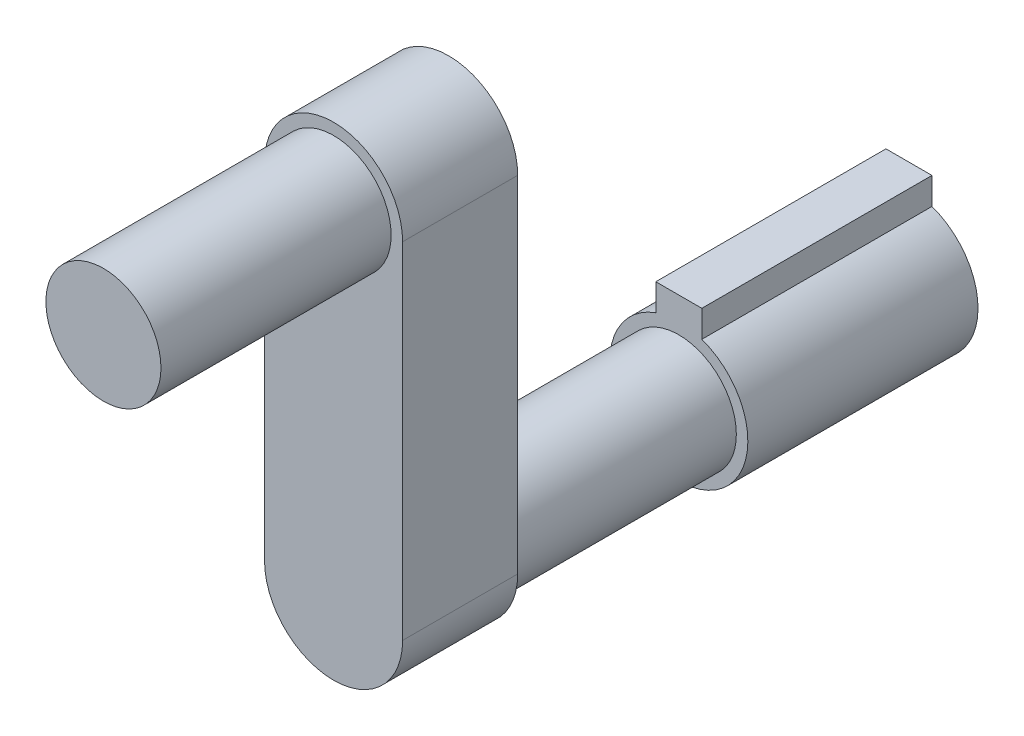
from build123d import *

# Parameters (mm, degrees)
SKETCH1_R           = 3
SKETCH1_W           = 2
SKETCH1_H           = 1.993597438
BOSS_EXTRUDE1_DEPTH = 10
SKETCH2_R           = 2.5
BOSS_EXTRUDE2_DEPTH = 10
BOSS_EXTRUDE3_DEPTH = 5
SKETCH4_R           = 2.5
BOSS_EXTRUDE4_DEPTH = 10
CUT_EXTRUDE1_DEPTH  = 2


with BuildPart() as part:
    # Sketch1 → Boss-Extrude1 (new body)
    with BuildSketch(Plane.XY):
        Circle(SKETCH1_R)
        with Locations((0, 3)):
            Rectangle(SKETCH1_W, SKETCH1_H)
    extrude(amount=BOSS_EXTRUDE1_DEPTH)

    # Sketch2 → Boss-Extrude2 (add)
    with BuildSketch(Plane.XY.offset(10)):
        Circle(SKETCH2_R)
    extrude(amount=BOSS_EXTRUDE2_DEPTH)

    # Sketch3 → Boss-Extrude3 (add)
    with BuildSketch(Plane.XY.offset(20)):
        with BuildLine():
            Line((-3, 0), (-3, 15))
            ThreePointArc((-3, 15), (0, 18), (3, 15))
            Line((3, 15), (3, 0))
            ThreePointArc((3, 0), (0, -3), (-3, 0))
        make_face()
    extrude(amount=BOSS_EXTRUDE3_DEPTH)

    # Sketch4 → Boss-Extrude4 (add)
    with BuildSketch(Plane.XY.offset(25)):
        with Locations((0, 15)):
            Circle(SKETCH4_R)
    extrude(amount=BOSS_EXTRUDE4_DEPTH)

    # Sketch5 → Cut-Extrude1 (cut)
    # profile 1 of 8: a face of its own
    with BuildSketch(Plane.ZY.offset(3)):
        Polygon((23.5, 13.967948718), (20, 13.070512821), (20, 13.266125801), (21.121794872, 13.553585737), (21.121794872, 14.427183494), (20, 14.714643429), (20, 14.91025641), (23.5, 14.012820513), align=None)
        Polygon((22.825520833, 13.990384615), (21.480769231, 14.335336538), (21.480769231, 13.645432692), align=None, mode=Mode.SUBTRACT)
    # profile 2 of 8: a face of its own
    with BuildSketch(Plane.ZY.offset(3)):
        with BuildLine():
            Line((23.5, 12.621794872), (23.5, 12.221454327))
            add(Edge.make_bspline(
                [(23.5, 12.221454327), (23.499948572, 12.193873317), (23.499850043, 12.14103227), (23.496829887, 12.065299003), (23.492819595, 11.996550011), (23.487166239, 11.934836389), (23.480740953, 11.880183731), (23.471213625, 11.832801839), (23.46158277, 11.79188376), (23.451886864, 11.767742603), (23.447415865, 11.756610577)],
                knots=[0, 0, 0, 0, 1.407566913, 2.696685497, 3.867828598, 4.921830392, 5.859837627, 6.673925321, 7.388517365, 8, 8, 8, 8], degree=3))
            add(Edge.make_bspline(
                [(23.447415865, 11.756610577), (23.440742683, 11.742401785), (23.427309393, 11.713799114), (23.40061655, 11.673724741), (23.370127993, 11.635008538), (23.333578412, 11.599209739), (23.293025391, 11.564675096), (23.24694992, 11.532611069), (23.196713988, 11.501525933), (23.121224336, 11.463838643), (23.016733365, 11.423225023), (22.877992506, 11.389292357), (22.724448317, 11.369175697), (22.617117752, 11.366683214), (22.561197917, 11.365384615)],
                knots=[0, 0, 0, 0, 0.553256377, 1.11371962, 1.694624179, 2.289471274, 2.915681027, 3.572429464, 4.268350826, 4.998658557, 6.547095669, 8.213347778, 10.027132616, 12, 12, 12, 12], degree=3))
            add(Edge.make_bspline(
                [(22.561197917, 11.365384615), (22.505040457, 11.366653019), (22.397468554, 11.369082697), (22.243792712, 11.389500794), (22.105167198, 11.4224302), (22.000701268, 11.46252034), (21.926479576, 11.501903223), (21.875700354, 11.532431814), (21.829889818, 11.566188171), (21.789171896, 11.602710912), (21.753006354, 11.641655154), (21.721235977, 11.683016894), (21.694502679, 11.727395269), (21.680077944, 11.758573392), (21.672876603, 11.774138622)],
                knots=[0, 0, 0, 0, 1.952825664, 3.74071718, 5.381229334, 6.899986293, 7.616370985, 8.302357478, 8.959256933, 9.592540697, 10.202323864, 10.80556878, 11.403697397, 12, 12, 12, 12], degree=3))
            add(Edge.make_bspline(
                [(21.672876603, 11.774138622), (21.668226346, 11.78692598), (21.65812948, 11.814690524), (21.646583821, 11.861177602), (21.636889356, 11.915285182), (21.629573612, 11.976893496), (21.623281999, 12.045862257), (21.618336994, 12.122301312), (21.615598245, 12.206476521), (21.615457864, 12.265155603), (21.615384615, 12.295773237)],
                knots=[0, 0, 0, 0, 0.619037079, 1.344083888, 2.176664384, 3.120122337, 4.167065244, 5.329031212, 6.606339038, 8, 8, 8, 8], degree=3))
            Line((21.615384615, 12.295773237), (21.615384615, 12.442307692))
            Line((21.615384615, 12.442307692), (20, 12.442307692))
            Line((20, 12.442307692), (20, 12.621794872))
            Line((20, 12.621794872), (23.5, 12.621794872))
        make_face()
        with BuildLine():
            Line((23.141025641, 12.442307692), (21.974358974, 12.442307692))
            Line((21.974358974, 12.442307692), (21.966646635, 12.08193109))
            add(Edge.make_bspline(
                [(21.966646635, 12.08193109), (21.967359882, 12.047765269), (21.968684053, 11.984335173), (21.980486749, 11.896366104), (21.999024216, 11.822445749), (22.027619308, 11.761358247), (22.067149294, 11.711971357), (22.114700665, 11.668520799), (22.172928457, 11.631765674), (22.239620796, 11.600444215), (22.313035684, 11.575575282), (22.391859477, 11.558415561), (22.474368458, 11.54656598), (22.531006416, 11.545442741), (22.559795673, 11.544871795)],
                knots=[0, 0, 0, 0, 1.329792904, 2.468809182, 3.448961848, 4.287442407, 5.072039685, 5.896626355, 6.785171559, 7.741805687, 8.760572816, 9.796030922, 10.879715384, 12, 12, 12, 12], degree=3))
            add(Edge.make_bspline(
                [(22.559795673, 11.544871795), (22.587884929, 11.545447785), (22.643360445, 11.546585349), (22.724451818, 11.558495045), (22.802370491, 11.575549106), (22.875241319, 11.600588848), (22.941179558, 11.631503631), (22.998337896, 11.667371524), (23.045219989, 11.707905073), (23.082787459, 11.755263451), (23.109987385, 11.813434052), (23.127801412, 11.884729229), (23.139894517, 11.970280353), (23.140629304, 12.032334067), (23.141025641, 12.065805288)],
                knots=[0, 0, 0, 0, 1.12019996, 2.212364431, 3.264487487, 4.299774154, 5.280209096, 6.165086333, 6.984581303, 7.742073155, 8.559708351, 9.525797634, 10.665437272, 12, 12, 12, 12], degree=3))
            Line((23.141025641, 12.065805288), (23.141025641, 12.442307692))
        make_face(mode=Mode.SUBTRACT)
    # profile 3 of 8: a face of its own
    with BuildSketch(Plane.ZY.offset(3)):
        with BuildLine():
            Line((20.675180288, 11.141025641), (20.852564103, 10.965745192))
            add(Edge.make_bspline(
                [(20.852564103, 10.965745192), (20.806768346, 10.949744611), (20.720259541, 10.919519296), (20.601283703, 10.867798877), (20.500574658, 10.814026459), (20.416955282, 10.759199354), (20.352394551, 10.700886474), (20.304628194, 10.641252453), (20.274867785, 10.577996502), (20.271073827, 10.534130211), (20.269230769, 10.512820513)],
                knots=[0, 0, 0, 0, 1.492748025, 2.819821212, 3.988082992, 5.003566528, 5.889522271, 6.653521704, 7.345897614, 8, 8, 8, 8], degree=3))
            add(Edge.make_bspline(
                [(20.269230769, 10.512820513), (20.270111185, 10.494706829), (20.27188161, 10.458282067), (20.288542594, 10.404973591), (20.313881925, 10.35310121), (20.349955227, 10.304450531), (20.394391746, 10.259470854), (20.446271202, 10.219579999), (20.505336751, 10.185747632), (20.570321687, 10.157903991), (20.640106799, 10.136880794), (20.712163446, 10.120294045), (20.786667151, 10.111298426), (20.836884225, 10.109756968), (20.862379808, 10.108974359)],
                knots=[0, 0, 0, 0, 0.821828617, 1.652613082, 2.517772712, 3.438355577, 4.392920542, 5.385775988, 6.404911499, 7.480990239, 8.593819133, 9.715597115, 10.840191616, 12, 12, 12, 12], degree=3))
            add(Edge.make_bspline(
                [(20.862379808, 10.108974359), (20.891402852, 10.11005785), (20.949740995, 10.112235735), (21.036598401, 10.125568379), (21.122569089, 10.148995054), (21.177851345, 10.171275695), (21.205929487, 10.182592147)],
                knots=[0, 0, 0, 0, 0.984692046, 1.979292873, 2.97367247, 4, 4, 4, 4], degree=3))
            add(Edge.make_bspline(
                [(21.205929487, 10.182592147), (21.2259099, 10.191707025), (21.267397259, 10.210633171), (21.329547689, 10.24473407), (21.394866872, 10.283548669), (21.463581418, 10.326621416), (21.53451747, 10.376304059), (21.60856967, 10.430841495), (21.685732977, 10.490432906), (21.737474218, 10.532567574), (21.764022436, 10.554186699)],
                knots=[0, 0, 0, 0, 0.783604451, 1.62707747, 2.528335987, 3.495652022, 4.520695746, 5.618471111, 6.778047299, 8, 8, 8, 8], degree=3))
            add(Edge.make_bspline(
                [(21.764022436, 10.554186699), (21.790327899, 10.575817605), (21.840937447, 10.61743369), (21.915220737, 10.6750916), (21.982925819, 10.727484922), (22.045807706, 10.772188301), (22.101954598, 10.811633595), (22.153108417, 10.844084503), (22.197860511, 10.871049082), (22.226899839, 10.885063516), (22.240084135, 10.891426282)],
                knots=[0, 0, 0, 0, 1.39810774, 2.689844348, 3.860446666, 4.91224624, 5.857076204, 6.676854451, 7.399271836, 8, 8, 8, 8], degree=3))
            add(Edge.make_bspline(
                [(22.240084135, 10.891426282), (22.281535116, 10.909330783), (22.364628719, 10.945222563), (22.49666208, 10.979697801), (22.633061017, 11.002816857), (22.725861195, 11.005200889), (22.772936699, 11.006410256)],
                knots=[0, 0, 0, 0, 0.985017337, 1.9745887, 2.97255308, 4, 4, 4, 4], degree=3))
            add(Edge.make_bspline(
                [(22.772936699, 11.006410256), (22.809895808, 11.005578534), (22.882606434, 11.003942265), (22.989037414, 10.991785873), (23.090720373, 10.972471363), (23.186185505, 10.944516167), (23.274692259, 10.909820473), (23.354140424, 10.868273136), (23.42312148, 10.819061497), (23.482085686, 10.765021127), (23.529393155, 10.705898409), (23.565034831, 10.643896093), (23.585277552, 10.577847578), (23.588258236, 10.533043967), (23.58974359, 10.510717147)],
                knots=[0, 0, 0, 0, 1.267016723, 2.492635209, 3.668164557, 4.811825255, 5.898095375, 6.923330359, 7.877218101, 8.795783379, 9.656795591, 10.463916073, 11.234528935, 12, 12, 12, 12], degree=3))
            add(Edge.make_bspline(
                [(23.58974359, 10.510717147), (23.5882948, 10.486913885), (23.5853668, 10.438807577), (23.559692893, 10.368495535), (23.518544339, 10.301364186), (23.472815592, 10.247909946), (23.426756089, 10.207015443), (23.385343905, 10.174522649), (23.336613034, 10.142713646), (23.28174963, 10.109571422), (23.22022471, 10.076119089), (23.151806874, 10.042487042), (23.076931172, 10.008255385), (23.024459527, 9.985921119), (22.997295673, 9.974358974)],
                knots=[0, 0, 0, 0, 1.010981439, 2.043189844, 3.145628199, 4.352312797, 5.021689429, 5.766145213, 6.591348155, 7.497533611, 8.495006426, 9.571955896, 10.743034757, 12, 12, 12, 12], degree=3))
            Line((22.997295673, 9.974358974), (22.782051282, 10.142628205))
            add(Edge.make_bspline(
                [(22.782051282, 10.142628205), (22.804091142, 10.152288961), (22.846333135, 10.170804942), (22.905921581, 10.199874505), (22.959817354, 10.22695967), (23.00791356, 10.252878859), (23.049844193, 10.278188247), (23.086624211, 10.301856812), (23.117421928, 10.32470919), (23.149748667, 10.353331722), (23.1821268, 10.3891426), (23.210074363, 10.435250101), (23.22739846, 10.48358194), (23.229647669, 10.516659167), (23.230769231, 10.533153045)],
                knots=[0, 0, 0, 0, 1.380595433, 2.64607415, 3.803495892, 4.841587401, 5.779871171, 6.612990388, 7.350514443, 7.977472631, 9.088846696, 10.105320781, 11.055222839, 12, 12, 12, 12], degree=3))
            add(Edge.make_bspline(
                [(23.230769231, 10.533153045), (23.229466025, 10.553993228), (23.226879653, 10.595353163), (23.200229207, 10.653197448), (23.158609652, 10.704394743), (23.102186882, 10.747542162), (23.034979737, 10.782907324), (22.959113836, 10.808922792), (22.875702371, 10.824492041), (22.817643664, 10.826095169), (22.787660256, 10.826923077)],
                knots=[0, 0, 0, 0, 0.845592901, 1.678184239, 2.546323166, 3.517236357, 4.553727469, 5.633226106, 6.777720882, 8, 8, 8, 8], degree=3))
            add(Edge.make_bspline(
                [(22.787660256, 10.826923077), (22.750387151, 10.825699916), (22.67608552, 10.823261621), (22.584324909, 10.803490171), (22.51133772, 10.78025331), (22.454315857, 10.756931592), (22.395131376, 10.727210632), (22.355856614, 10.703785746), (22.335436699, 10.691606571)],
                knots=[0, 0, 0, 0, 1.400397992, 2.791606777, 3.511596025, 4.280421619, 5.105948858, 6, 6, 6, 6], degree=3))
            add(Edge.make_bspline(
                [(22.335436699, 10.691606571), (22.328629806, 10.686973989), (22.312702373, 10.676134223), (22.286164667, 10.656336006), (22.252886535, 10.630677518), (22.212360804, 10.599538138), (22.165695624, 10.561515935), (22.112075938, 10.517936402), (22.052024155, 10.468091917), (22.009431655, 10.433106109), (21.986979167, 10.414663462)],
                knots=[0, 0, 0, 0, 0.443798571, 1.038443339, 1.784280503, 2.709093875, 3.79317689, 5.028804332, 6.433744489, 8, 8, 8, 8], degree=3))
            add(Edge.make_bspline(
                [(21.986979167, 10.414663462), (21.959251456, 10.392356384), (21.905154971, 10.348835499), (21.824600774, 10.286903757), (21.746077579, 10.230701988), (21.669738407, 10.180349272), (21.596044549, 10.135071167), (21.524277277, 10.095877848), (21.455043102, 10.061186217), (21.366086296, 10.023327118), (21.255969344, 9.986123263), (21.123483627, 9.953647502), (20.990633516, 9.933002658), (20.901715055, 9.930655202), (20.857471955, 9.929487179)],
                knots=[0, 0, 0, 0, 1.019693231, 1.989411284, 2.911117387, 3.785919386, 4.609387671, 5.388618189, 6.128346314, 6.827399301, 8.157317944, 9.453423902, 10.732901827, 12, 12, 12, 12], degree=3))
            add(Edge.make_bspline(
                [(20.857471955, 9.929487179), (20.82614066, 9.930076639), (20.764318294, 9.931239751), (20.673197126, 9.938920996), (20.585102646, 9.952174904), (20.500180282, 9.971337739), (20.418022269, 9.994871377), (20.339209417, 10.024338207), (20.264043042, 10.05983885), (20.192374853, 10.09894006), (20.127091719, 10.14281746), (20.069191326, 10.188826711), (20.020296616, 10.237350223), (19.980305384, 10.288382091), (19.949237443, 10.341999239), (19.926423444, 10.397799424), (19.91242622, 10.456276988), (19.910985421, 10.49615087), (19.91025641, 10.516326122)],
                knots=[0, 0, 0, 0, 1.230704376, 2.428404448, 3.58911904, 4.727250619, 5.845775478, 6.943883352, 8.028127475, 9.108829135, 10.147661164, 11.113991069, 12.009808747, 12.847178372, 13.653371422, 14.435851608, 15.208577505, 16, 16, 16, 16], degree=3))
            add(Edge.make_bspline(
                [(19.91025641, 10.516326122), (19.910770129, 10.531796761), (19.911797391, 10.56273273), (19.920945594, 10.608459304), (19.933540426, 10.653600292), (19.954152118, 10.696602395), (19.978653207, 10.73905966), (20.008952633, 10.78043382), (20.044954232, 10.820504418), (20.08685797, 10.859266992), (20.134941163, 10.897518539), (20.190516104, 10.934379106), (20.253425045, 10.970779136), (20.323000756, 11.007405545), (20.400992001, 11.04130673), (20.485526413, 11.075687299), (20.577635891, 11.109454449), (20.641919898, 11.130260593), (20.675180288, 11.141025641)],
                knots=[0, 0, 0, 0, 0.703637613, 1.407033772, 2.117478485, 2.831738548, 3.570931179, 4.347844512, 5.161774225, 6.020127363, 6.944175601, 7.956531597, 9.053447769, 10.252889659, 11.534358192, 12.923572509, 14.408263844, 16, 16, 16, 16], degree=3))
        make_face()
    # profile 4 of 8: a face of its own
    with BuildSketch(Plane.ZY.offset(3)):
        with BuildLine():
            Line((22.857772436, 7.596153846), (22.647435897, 7.758814103))
            add(Edge.make_bspline(
                [(22.647435897, 7.758814103), (22.692776531, 7.781562664), (22.780085367, 7.82536775), (22.898713127, 7.902425364), (22.999368999, 7.987162247), (23.082960794, 8.077847119), (23.149419037, 8.174293004), (23.196147677, 8.276800328), (23.225803666, 8.383960886), (23.229109375, 8.457410489), (23.230769231, 8.494290865)],
                knots=[0, 0, 0, 0, 1.225477736, 2.359804546, 3.409995788, 4.397567392, 5.332917671, 6.22771367, 7.110102915, 8, 8, 8, 8], degree=3))
            add(Edge.make_bspline(
                [(23.230769231, 8.494290865), (23.230371308, 8.514671172), (23.229579787, 8.555210255), (23.218824088, 8.615217769), (23.203770677, 8.67429278), (23.181842411, 8.732121428), (23.15323281, 8.788310229), (23.11986102, 8.844258716), (23.078457637, 8.897894324), (23.032595156, 8.951295719), (22.980659196, 9.002000981), (22.924710389, 9.050571148), (22.863992152, 9.095408038), (22.799387496, 9.137568468), (22.730486537, 9.176745082), (22.657466242, 9.213570951), (22.579630116, 9.245967297), (22.469986252, 9.28682551), (22.324700804, 9.328957718), (22.141294595, 9.365200338), (21.947329078, 9.387428306), (21.814563757, 9.389806388), (21.746494391, 9.391025641)],
                knots=[0, 0, 0, 0, 0.641072609, 1.27517683, 1.914344945, 2.55962964, 3.218006293, 3.89843944, 4.608029295, 5.348959021, 6.11410062, 6.891744901, 7.680836169, 8.489326988, 9.320160762, 10.176050412, 11.063333565, 11.97397225, 13.860712496, 15.819659649, 17.856721063, 20, 20, 20, 20], degree=3))
            add(Edge.make_bspline(
                [(21.746494391, 9.391025641), (21.69482339, 9.390186649), (21.593677813, 9.388544327), (21.44520389, 9.376599632), (21.30357498, 9.356283793), (21.168095448, 9.328392679), (21.039268968, 9.291954872), (20.916528732, 9.247862874), (20.800788839, 9.195174454), (20.692524641, 9.135413917), (20.594193036, 9.06929511), (20.507237078, 8.998929269), (20.434271735, 8.923125189), (20.373905308, 8.843654699), (20.326671882, 8.759282045), (20.294089239, 8.670225713), (20.272317585, 8.577365052), (20.270267571, 8.513812566), (20.269230769, 8.481670673)],
                knots=[0, 0, 0, 0, 1.296265952, 2.537430365, 3.733959494, 4.883883303, 6.00498481, 7.090011517, 8.152708702, 9.192034827, 10.188898666, 11.122065806, 11.992878817, 12.821949746, 13.619810597, 14.408309511, 15.19499696, 16, 16, 16, 16], degree=3))
            add(Edge.make_bspline(
                [(20.269230769, 8.481670673), (20.270922193, 8.446192082), (20.274278583, 8.375789876), (20.303374225, 8.272835141), (20.349321451, 8.174434002), (20.414409923, 8.080964022), (20.498095468, 7.992945323), (20.598979308, 7.90875097), (20.718417494, 7.829322479), (20.806528823, 7.78301056), (20.852564103, 7.758814103)],
                knots=[0, 0, 0, 0, 0.867201894, 1.720838504, 2.598846134, 3.516224563, 4.495888817, 5.564045298, 6.727293588, 8, 8, 8, 8], degree=3))
            Line((20.852564103, 7.758814103), (20.644330929, 7.596153846))
            add(Edge.make_bspline(
                [(20.644330929, 7.596153846), (20.615918925, 7.608725144), (20.559877676, 7.633521397), (20.479693328, 7.67486851), (20.404115156, 7.718279745), (20.334032458, 7.764938338), (20.268062191, 7.812810104), (20.20760461, 7.863630609), (20.151801283, 7.916256218), (20.101395944, 7.971551828), (20.056465211, 8.028870121), (20.017545657, 8.088224701), (19.984654117, 8.149287817), (19.95702617, 8.211742628), (19.93583031, 8.275843217), (19.921275326, 8.341635313), (19.911655632, 8.408936304), (19.910724736, 8.454527436), (19.91025641, 8.477463942)],
                knots=[0, 0, 0, 0, 1.224426466, 2.415119558, 3.554345693, 4.6581201, 5.73232009, 6.765566526, 7.769062807, 8.753735059, 9.711981524, 10.636925446, 11.547863011, 12.443012552, 13.325703329, 14.204008697, 15.096452203, 16, 16, 16, 16], degree=3))
            add(Edge.make_bspline(
                [(19.91025641, 8.477463942), (19.910525197, 8.499226939), (19.911058767, 8.542428775), (19.919442294, 8.606097868), (19.931024725, 8.66831055), (19.948125333, 8.728431503), (19.968943222, 8.787340414), (19.995900834, 8.843785966), (20.026830857, 8.898993571), (20.062866875, 8.952308189), (20.103177255, 9.004275168), (20.149652822, 9.053466579), (20.199735236, 9.10169909), (20.25465476, 9.14822303), (20.31464515, 9.192302272), (20.379055506, 9.235170321), (20.448740687, 9.275833629), (20.49744806, 9.30102856), (20.522335737, 9.313902244)],
                knots=[0, 0, 0, 0, 0.951483691, 1.888795086, 2.805292916, 3.718304322, 4.620775644, 5.535674798, 6.451430733, 7.387346612, 8.348778872, 9.325586392, 10.345339298, 11.390162498, 12.472057736, 13.600827389, 14.77411096, 16, 16, 16, 16], degree=3))
            add(Edge.make_bspline(
                [(20.522335737, 9.313902244), (20.566213736, 9.334686156), (20.654955946, 9.376721125), (20.795072835, 9.427751962), (20.941312353, 9.472197856), (21.094191709, 9.508558984), (21.253859985, 9.536643143), (21.420099274, 9.555795015), (21.592997845, 9.568080087), (21.710482113, 9.569691774), (21.770332532, 9.570512821)],
                knots=[0, 0, 0, 0, 0.906154086, 1.832675129, 2.781094794, 3.759121532, 4.764995586, 5.806439983, 6.882527099, 8, 8, 8, 8], degree=3))
            add(Edge.make_bspline(
                [(21.770332532, 9.570512821), (21.833233372, 9.569633734), (21.95664193, 9.567909007), (22.137760907, 9.552502), (22.31145268, 9.529515309), (22.477098713, 9.494650238), (22.63574796, 9.451649368), (22.786277141, 9.397497545), (22.929594662, 9.334258212), (23.063606808, 9.261942745), (23.186641678, 9.183357473), (23.29374504, 9.097691409), (23.384605272, 9.007241351), (23.460193508, 8.912367199), (23.518222624, 8.811356718), (23.559463276, 8.705261651), (23.584847836, 8.594341217), (23.588103016, 8.518494388), (23.58974359, 8.480268429)],
                knots=[0, 0, 0, 0, 1.293843798, 2.538462092, 3.737286409, 4.896222341, 6.018388779, 7.116449574, 8.184140796, 9.238277773, 10.246533469, 11.183676305, 12.054053577, 12.879343071, 13.671938145, 14.440724158, 15.214142311, 16, 16, 16, 16], degree=3))
            add(Edge.make_bspline(
                [(23.58974359, 8.480268429), (23.589265029, 8.456868419), (23.588318489, 8.41058576), (23.578943888, 8.342242038), (23.563308865, 8.275928149), (23.542122794, 8.211235209), (23.515624497, 8.147542318), (23.481651363, 8.086152975), (23.442301391, 8.026352748), (23.397244053, 7.968702205), (23.346545213, 7.913485507), (23.291298803, 7.860021701), (23.230587774, 7.809858034), (23.166070978, 7.760860797), (23.095876913, 7.715831225), (23.021227962, 7.672568151), (22.94130863, 7.632990509), (22.885912543, 7.60856269), (22.857772436, 7.596153846)],
                knots=[0, 0, 0, 0, 0.92065626, 1.820957336, 2.709050054, 3.59923666, 4.49793837, 5.420064155, 6.356442129, 7.313336463, 8.296619297, 9.305055395, 10.336843872, 11.394752583, 12.491929066, 13.616981075, 14.789473945, 16, 16, 16, 16], degree=3))
        make_face()
    # profile 5 of 8: a face of its own
    with BuildSketch(Plane.ZY.offset(3)):
        with BuildLine():
            Line((23.5, 6.33974359), (23.5, 5.939403045))
            add(Edge.make_bspline(
                [(23.5, 5.939403045), (23.499948572, 5.911822035), (23.499850043, 5.858980988), (23.496829887, 5.783247721), (23.492819595, 5.714498729), (23.487166239, 5.652785107), (23.480740953, 5.598132449), (23.471213625, 5.550750557), (23.46158277, 5.509832478), (23.451886864, 5.485691321), (23.447415865, 5.474559295)],
                knots=[0, 0, 0, 0, 1.407566913, 2.696685497, 3.867828598, 4.921830392, 5.859837627, 6.673925321, 7.388517365, 8, 8, 8, 8], degree=3))
            add(Edge.make_bspline(
                [(23.447415865, 5.474559295), (23.440742683, 5.460350503), (23.427309393, 5.431747832), (23.40061655, 5.391673459), (23.370127993, 5.352957256), (23.333578412, 5.317158457), (23.293025391, 5.282623814), (23.24694992, 5.250559787), (23.196713988, 5.219474651), (23.121224336, 5.181787361), (23.016733365, 5.141173741), (22.877992506, 5.107241075), (22.724448317, 5.087124415), (22.617117752, 5.084631932), (22.561197917, 5.083333333)],
                knots=[0, 0, 0, 0, 0.553256377, 1.11371962, 1.694624179, 2.289471274, 2.915681027, 3.572429464, 4.268350826, 4.998658557, 6.547095669, 8.213347778, 10.027132616, 12, 12, 12, 12], degree=3))
            add(Edge.make_bspline(
                [(22.561197917, 5.083333333), (22.505040457, 5.084601737), (22.397468554, 5.087031415), (22.243792712, 5.107449512), (22.105167198, 5.140378918), (22.000701268, 5.180469058), (21.926479576, 5.219851941), (21.875700354, 5.250380532), (21.829889818, 5.284136889), (21.789171896, 5.32065963), (21.753006354, 5.359603872), (21.721235977, 5.400965612), (21.694502679, 5.445343987), (21.680077944, 5.47652211), (21.672876603, 5.49208734)],
                knots=[0, 0, 0, 0, 1.952825664, 3.74071718, 5.381229334, 6.899986293, 7.616370985, 8.302357478, 8.959256933, 9.592540697, 10.202323864, 10.80556878, 11.403697397, 12, 12, 12, 12], degree=3))
            add(Edge.make_bspline(
                [(21.672876603, 5.49208734), (21.668226346, 5.504874698), (21.65812948, 5.532639242), (21.646583821, 5.57912632), (21.636889356, 5.6332339), (21.629573612, 5.694842214), (21.623281999, 5.763810975), (21.618336994, 5.84025003), (21.615598245, 5.924425239), (21.615457864, 5.983104321), (21.615384615, 6.013721955)],
                knots=[0, 0, 0, 0, 0.619037079, 1.344083888, 2.176664384, 3.120122337, 4.167065244, 5.329031212, 6.606339038, 8, 8, 8, 8], degree=3))
            Line((21.615384615, 6.013721955), (21.615384615, 6.16025641))
            Line((21.615384615, 6.16025641), (20, 6.16025641))
            Line((20, 6.16025641), (20, 6.33974359))
            Line((20, 6.33974359), (23.5, 6.33974359))
        make_face()
        with BuildLine():
            Line((23.141025641, 6.16025641), (21.974358974, 6.16025641))
            Line((21.974358974, 6.16025641), (21.966646635, 5.799879808))
            add(Edge.make_bspline(
                [(21.966646635, 5.799879808), (21.967359882, 5.765713987), (21.968684053, 5.702283891), (21.980486749, 5.614314822), (21.999024216, 5.540394467), (22.027619308, 5.479306965), (22.067149294, 5.429920075), (22.114700665, 5.386469517), (22.172928457, 5.349714392), (22.239620796, 5.318392933), (22.313035684, 5.293524), (22.391859477, 5.276364279), (22.474368458, 5.264514698), (22.531006416, 5.263391459), (22.559795673, 5.262820513)],
                knots=[0, 0, 0, 0, 1.329792904, 2.468809182, 3.448961848, 4.287442407, 5.072039685, 5.896626355, 6.785171559, 7.741805687, 8.760572816, 9.796030922, 10.879715384, 12, 12, 12, 12], degree=3))
            add(Edge.make_bspline(
                [(22.559795673, 5.262820513), (22.587884929, 5.263396503), (22.643360445, 5.264534067), (22.724451818, 5.276443763), (22.802370491, 5.293497824), (22.875241319, 5.318537566), (22.941179558, 5.349452349), (22.998337896, 5.385320242), (23.045219989, 5.425853791), (23.082787459, 5.473212169), (23.109987385, 5.53138277), (23.127801412, 5.602677947), (23.139894517, 5.688229071), (23.140629304, 5.750282785), (23.141025641, 5.783754006)],
                knots=[0, 0, 0, 0, 1.12019996, 2.212364431, 3.264487487, 4.299774154, 5.280209096, 6.165086333, 6.984581303, 7.742073155, 8.559708351, 9.525797634, 10.665437272, 12, 12, 12, 12], degree=3))
            Line((23.141025641, 5.783754006), (23.141025641, 6.16025641))
        make_face(mode=Mode.SUBTRACT)
    # profile 6 of 8: a face of its own
    with BuildSketch(Plane.ZY.offset(3)):
        Polygon((23.5, 3.871794872), (20, 2.974358974), (20, 3.169971955), (21.121794872, 3.457431891), (21.121794872, 4.331029647), (20, 4.618489583), (20, 4.814102564), (23.5, 3.916666667), align=None)
        Polygon((22.825520833, 3.894230769), (21.480769231, 4.239182692), (21.480769231, 3.549278846), align=None, mode=Mode.SUBTRACT)
    # profile 7 of 8: a face of its own
    with BuildSketch(Plane.ZY.offset(3)):
        with BuildLine():
            Line((20.675180288, 2.75), (20.852564103, 2.574719551))
            add(Edge.make_bspline(
                [(20.852564103, 2.574719551), (20.806768346, 2.55871897), (20.720259541, 2.528493655), (20.601283703, 2.476773236), (20.500574658, 2.423000818), (20.416955282, 2.368173713), (20.352394551, 2.309860833), (20.304628194, 2.250226812), (20.274867785, 2.186970861), (20.271073827, 2.14310457), (20.269230769, 2.121794872)],
                knots=[0, 0, 0, 0, 1.492748025, 2.819821212, 3.988082992, 5.003566528, 5.889522271, 6.653521704, 7.345897614, 8, 8, 8, 8], degree=3))
            add(Edge.make_bspline(
                [(20.269230769, 2.121794872), (20.270111185, 2.103681188), (20.27188161, 2.067256426), (20.288542594, 2.01394795), (20.313881925, 1.962075569), (20.349955227, 1.91342489), (20.394391746, 1.868445213), (20.446271202, 1.828554358), (20.505336751, 1.794721991), (20.570321687, 1.76687835), (20.640106799, 1.745855153), (20.712163446, 1.729268404), (20.786667151, 1.720272785), (20.836884225, 1.718731327), (20.862379808, 1.717948718)],
                knots=[0, 0, 0, 0, 0.821828617, 1.652613082, 2.517772712, 3.438355577, 4.392920542, 5.385775988, 6.404911499, 7.480990239, 8.593819133, 9.715597115, 10.840191616, 12, 12, 12, 12], degree=3))
            add(Edge.make_bspline(
                [(20.862379808, 1.717948718), (20.891402852, 1.719032209), (20.949740995, 1.721210094), (21.036598401, 1.734542738), (21.122569089, 1.757969413), (21.177851345, 1.780250054), (21.205929487, 1.791566506)],
                knots=[0, 0, 0, 0, 0.984692046, 1.979292873, 2.97367247, 4, 4, 4, 4], degree=3))
            add(Edge.make_bspline(
                [(21.205929487, 1.791566506), (21.2259099, 1.800681384), (21.267397259, 1.81960753), (21.329547689, 1.853708429), (21.394866872, 1.892523028), (21.463581418, 1.935595775), (21.53451747, 1.985278418), (21.60856967, 2.039815854), (21.685732977, 2.099407265), (21.737474218, 2.141541933), (21.764022436, 2.163161058)],
                knots=[0, 0, 0, 0, 0.783604451, 1.62707747, 2.528335987, 3.495652022, 4.520695746, 5.618471111, 6.778047299, 8, 8, 8, 8], degree=3))
            add(Edge.make_bspline(
                [(21.764022436, 2.163161058), (21.790327899, 2.184791964), (21.840937447, 2.226408049), (21.915220737, 2.284065959), (21.982925819, 2.336459281), (22.045807706, 2.38116266), (22.101954598, 2.420607954), (22.153108417, 2.453058862), (22.197860511, 2.480023441), (22.226899839, 2.494037875), (22.240084135, 2.500400641)],
                knots=[0, 0, 0, 0, 1.39810774, 2.689844348, 3.860446666, 4.91224624, 5.857076204, 6.676854451, 7.399271836, 8, 8, 8, 8], degree=3))
            add(Edge.make_bspline(
                [(22.240084135, 2.500400641), (22.281535116, 2.518305142), (22.364628719, 2.554196922), (22.49666208, 2.58867216), (22.633061017, 2.611791216), (22.725861195, 2.614175248), (22.772936699, 2.615384615)],
                knots=[0, 0, 0, 0, 0.985017337, 1.9745887, 2.97255308, 4, 4, 4, 4], degree=3))
            add(Edge.make_bspline(
                [(22.772936699, 2.615384615), (22.809895808, 2.614552893), (22.882606434, 2.612916623), (22.989037414, 2.600760232), (23.090720373, 2.581445722), (23.186185505, 2.553490526), (23.274692259, 2.518794832), (23.354140424, 2.477247495), (23.42312148, 2.428035856), (23.482085686, 2.373995486), (23.529393155, 2.314872768), (23.565034831, 2.252870452), (23.585277552, 2.186821937), (23.588258236, 2.142018326), (23.58974359, 2.119691506)],
                knots=[0, 0, 0, 0, 1.267016723, 2.492635209, 3.668164557, 4.811825255, 5.898095375, 6.923330359, 7.877218101, 8.795783379, 9.656795591, 10.463916073, 11.234528935, 12, 12, 12, 12], degree=3))
            add(Edge.make_bspline(
                [(23.58974359, 2.119691506), (23.5882948, 2.095888244), (23.5853668, 2.047781936), (23.559692893, 1.977469894), (23.518544339, 1.910338545), (23.472815592, 1.856884305), (23.426756089, 1.815989802), (23.385343905, 1.783497008), (23.336613034, 1.751688005), (23.28174963, 1.718545781), (23.22022471, 1.685093448), (23.151806874, 1.651461401), (23.076931172, 1.617229744), (23.024459527, 1.594895478), (22.997295673, 1.583333333)],
                knots=[0, 0, 0, 0, 1.010981439, 2.043189844, 3.145628199, 4.352312797, 5.021689429, 5.766145213, 6.591348155, 7.497533611, 8.495006426, 9.571955896, 10.743034757, 12, 12, 12, 12], degree=3))
            Line((22.997295673, 1.583333333), (22.782051282, 1.751602564))
            add(Edge.make_bspline(
                [(22.782051282, 1.751602564), (22.804091142, 1.76126332), (22.846333135, 1.779779301), (22.905921581, 1.808848864), (22.959817354, 1.835934029), (23.00791356, 1.861853218), (23.049844193, 1.887162606), (23.086624211, 1.91083117), (23.117421928, 1.933683549), (23.149748667, 1.962306081), (23.1821268, 1.998116959), (23.210074363, 2.04422446), (23.22739846, 2.092556299), (23.229647669, 2.125633526), (23.230769231, 2.142127404)],
                knots=[0, 0, 0, 0, 1.380595433, 2.64607415, 3.803495892, 4.841587401, 5.779871171, 6.612990388, 7.350514443, 7.977472631, 9.088846696, 10.105320781, 11.055222839, 12, 12, 12, 12], degree=3))
            add(Edge.make_bspline(
                [(23.230769231, 2.142127404), (23.229466025, 2.162967587), (23.226879653, 2.204327522), (23.200229207, 2.262171807), (23.158609652, 2.313369102), (23.102186882, 2.356516521), (23.034979737, 2.391881683), (22.959113836, 2.417897151), (22.875702371, 2.4334664), (22.817643664, 2.435069528), (22.787660256, 2.435897436)],
                knots=[0, 0, 0, 0, 0.845592901, 1.678184239, 2.546323166, 3.517236357, 4.553727469, 5.633226106, 6.777720882, 8, 8, 8, 8], degree=3))
            add(Edge.make_bspline(
                [(22.787660256, 2.435897436), (22.750387151, 2.434674275), (22.67608552, 2.43223598), (22.584324909, 2.41246453), (22.51133772, 2.389227669), (22.454315857, 2.365905951), (22.395131376, 2.336184991), (22.355856614, 2.312760105), (22.335436699, 2.300580929)],
                knots=[0, 0, 0, 0, 1.400397992, 2.791606777, 3.511596025, 4.280421619, 5.105948858, 6, 6, 6, 6], degree=3))
            add(Edge.make_bspline(
                [(22.335436699, 2.300580929), (22.328629806, 2.295948348), (22.312702373, 2.285108582), (22.286164667, 2.265310365), (22.252886535, 2.239651877), (22.212360804, 2.208512497), (22.165695624, 2.170490294), (22.112075938, 2.126910761), (22.052024155, 2.077066276), (22.009431655, 2.042080468), (21.986979167, 2.023637821)],
                knots=[0, 0, 0, 0, 0.443798571, 1.038443339, 1.784280503, 2.709093875, 3.79317689, 5.028804332, 6.433744489, 8, 8, 8, 8], degree=3))
            add(Edge.make_bspline(
                [(21.986979167, 2.023637821), (21.959251456, 2.001330743), (21.905154971, 1.957809858), (21.824600774, 1.895878116), (21.746077579, 1.839676347), (21.669738407, 1.789323631), (21.596044549, 1.744045526), (21.524277277, 1.704852207), (21.455043102, 1.670160576), (21.366086296, 1.632301476), (21.255969344, 1.595097621), (21.123483627, 1.562621861), (20.990633516, 1.541977017), (20.901715055, 1.539629561), (20.857471955, 1.538461538)],
                knots=[0, 0, 0, 0, 1.019693231, 1.989411284, 2.911117387, 3.785919386, 4.609387671, 5.388618189, 6.128346314, 6.827399301, 8.157317944, 9.453423902, 10.732901827, 12, 12, 12, 12], degree=3))
            add(Edge.make_bspline(
                [(20.857471955, 1.538461538), (20.82614066, 1.539050998), (20.764318294, 1.54021411), (20.673197126, 1.547895355), (20.585102646, 1.561149263), (20.500180282, 1.580312098), (20.418022269, 1.603845736), (20.339209417, 1.633312566), (20.264043042, 1.668813209), (20.192374853, 1.707914419), (20.127091719, 1.751791819), (20.069191326, 1.79780107), (20.020296616, 1.846324582), (19.980305384, 1.89735645), (19.949237443, 1.950973598), (19.926423444, 2.006773783), (19.91242622, 2.065251347), (19.910985421, 2.105125229), (19.91025641, 2.125300481)],
                knots=[0, 0, 0, 0, 1.230704376, 2.428404448, 3.58911904, 4.727250619, 5.845775478, 6.943883352, 8.028127475, 9.108829135, 10.147661164, 11.113991069, 12.009808747, 12.847178372, 13.653371422, 14.435851608, 15.208577505, 16, 16, 16, 16], degree=3))
            add(Edge.make_bspline(
                [(19.91025641, 2.125300481), (19.910770129, 2.14077112), (19.911797391, 2.171707088), (19.920945594, 2.217433663), (19.933540426, 2.262574651), (19.954152118, 2.305576754), (19.978653207, 2.348034019), (20.008952633, 2.389408179), (20.044954232, 2.429478777), (20.08685797, 2.468241351), (20.134941163, 2.506492898), (20.190516104, 2.543353465), (20.253425045, 2.579753495), (20.323000756, 2.616379904), (20.400992001, 2.650281089), (20.485526413, 2.684661658), (20.577635891, 2.718428808), (20.641919898, 2.739234952), (20.675180288, 2.75)],
                knots=[0, 0, 0, 0, 0.703637613, 1.407033772, 2.117478485, 2.831738548, 3.570931179, 4.347844512, 5.161774225, 6.020127363, 6.944175601, 7.956531597, 9.053447769, 10.252889659, 11.534358192, 12.923572509, 14.408263844, 16, 16, 16, 16], degree=3))
        make_face()
    # profile 8 of 8: a face of its own
    with BuildSketch(Plane.ZY.offset(3)):
        with BuildLine():
            Line((20.675180288, 1.314102564), (20.852564103, 1.138822115))
            add(Edge.make_bspline(
                [(20.852564103, 1.138822115), (20.806768346, 1.122821534), (20.720259541, 1.092596219), (20.601283703, 1.0408758), (20.500574658, 0.987103382), (20.416955282, 0.932276277), (20.352394551, 0.873963397), (20.304628194, 0.814329376), (20.274867785, 0.751073425), (20.271073827, 0.707207134), (20.269230769, 0.685897436)],
                knots=[0, 0, 0, 0, 1.492748025, 2.819821212, 3.988082992, 5.003566528, 5.889522271, 6.653521704, 7.345897614, 8, 8, 8, 8], degree=3))
            add(Edge.make_bspline(
                [(20.269230769, 0.685897436), (20.270111185, 0.667783752), (20.27188161, 0.631358991), (20.288542594, 0.578050514), (20.313881925, 0.526178134), (20.349955227, 0.477527454), (20.394391746, 0.432547777), (20.446271202, 0.392656922), (20.505336751, 0.358824555), (20.570321687, 0.330980914), (20.640106799, 0.309957717), (20.712163446, 0.293370968), (20.786667151, 0.284375349), (20.836884225, 0.282833892), (20.862379808, 0.282051282)],
                knots=[0, 0, 0, 0, 0.821828617, 1.652613082, 2.517772712, 3.438355577, 4.392920542, 5.385775988, 6.404911499, 7.480990239, 8.593819133, 9.715597115, 10.840191616, 12, 12, 12, 12], degree=3))
            add(Edge.make_bspline(
                [(20.862379808, 0.282051282), (20.891402852, 0.283134773), (20.949740995, 0.285312658), (21.036598401, 0.298645302), (21.122569089, 0.322071977), (21.177851345, 0.344352618), (21.205929487, 0.355669071)],
                knots=[0, 0, 0, 0, 0.984692046, 1.979292873, 2.97367247, 4, 4, 4, 4], degree=3))
            add(Edge.make_bspline(
                [(21.205929487, 0.355669071), (21.2259099, 0.364783948), (21.267397259, 0.383710094), (21.329547689, 0.417810993), (21.394866872, 0.456625592), (21.463581418, 0.499698339), (21.53451747, 0.549380982), (21.60856967, 0.603918418), (21.685732977, 0.663509829), (21.737474218, 0.705644497), (21.764022436, 0.727263622)],
                knots=[0, 0, 0, 0, 0.783604451, 1.62707747, 2.528335987, 3.495652022, 4.520695746, 5.618471111, 6.778047299, 8, 8, 8, 8], degree=3))
            add(Edge.make_bspline(
                [(21.764022436, 0.727263622), (21.790327899, 0.748894528), (21.840937447, 0.790510613), (21.915220737, 0.848168523), (21.982925819, 0.900561845), (22.045807706, 0.945265224), (22.101954598, 0.984710518), (22.153108417, 1.017161426), (22.197860511, 1.044126005), (22.226899839, 1.058140439), (22.240084135, 1.064503205)],
                knots=[0, 0, 0, 0, 1.39810774, 2.689844348, 3.860446666, 4.91224624, 5.857076204, 6.676854451, 7.399271836, 8, 8, 8, 8], degree=3))
            add(Edge.make_bspline(
                [(22.240084135, 1.064503205), (22.281535116, 1.082407706), (22.364628719, 1.118299486), (22.49666208, 1.152774724), (22.633061017, 1.17589378), (22.725861195, 1.178277812), (22.772936699, 1.179487179)],
                knots=[0, 0, 0, 0, 0.985017337, 1.9745887, 2.97255308, 4, 4, 4, 4], degree=3))
            add(Edge.make_bspline(
                [(22.772936699, 1.179487179), (22.809895808, 1.178655457), (22.882606434, 1.177019188), (22.989037414, 1.164862796), (23.090720373, 1.145548286), (23.186185505, 1.11759309), (23.274692259, 1.082897396), (23.354140424, 1.041350059), (23.42312148, 0.99213842), (23.482085686, 0.93809805), (23.529393155, 0.878975332), (23.565034831, 0.816973016), (23.585277552, 0.750924502), (23.588258236, 0.70612089), (23.58974359, 0.683794071)],
                knots=[0, 0, 0, 0, 1.267016723, 2.492635209, 3.668164557, 4.811825255, 5.898095375, 6.923330359, 7.877218101, 8.795783379, 9.656795591, 10.463916073, 11.234528935, 12, 12, 12, 12], degree=3))
            add(Edge.make_bspline(
                [(23.58974359, 0.683794071), (23.5882948, 0.659990808), (23.5853668, 0.6118845), (23.559692893, 0.541572458), (23.518544339, 0.474441109), (23.472815592, 0.420986869), (23.426756089, 0.380092366), (23.385343905, 0.347599572), (23.336613034, 0.315790569), (23.28174963, 0.282648345), (23.22022471, 0.249196012), (23.151806874, 0.215563965), (23.076931172, 0.181332308), (23.024459527, 0.158998042), (22.997295673, 0.147435897)],
                knots=[0, 0, 0, 0, 1.010981439, 2.043189844, 3.145628199, 4.352312797, 5.021689429, 5.766145213, 6.591348155, 7.497533611, 8.495006426, 9.571955896, 10.743034757, 12, 12, 12, 12], degree=3))
            Line((22.997295673, 0.147435897), (22.782051282, 0.315705128))
            add(Edge.make_bspline(
                [(22.782051282, 0.315705128), (22.804091142, 0.325365885), (22.846333135, 0.343881865), (22.905921581, 0.372951428), (22.959817354, 0.400036593), (23.00791356, 0.425955782), (23.049844193, 0.45126517), (23.086624211, 0.474933735), (23.117421928, 0.497786114), (23.149748667, 0.526408645), (23.1821268, 0.562219523), (23.210074363, 0.608327024), (23.22739846, 0.656658863), (23.229647669, 0.68973609), (23.230769231, 0.706229968)],
                knots=[0, 0, 0, 0, 1.380595433, 2.64607415, 3.803495892, 4.841587401, 5.779871171, 6.612990388, 7.350514443, 7.977472631, 9.088846696, 10.105320781, 11.055222839, 12, 12, 12, 12], degree=3))
            add(Edge.make_bspline(
                [(23.230769231, 0.706229968), (23.229466025, 0.727070151), (23.226879653, 0.768430086), (23.200229207, 0.826274371), (23.158609652, 0.877471666), (23.102186882, 0.920619085), (23.034979737, 0.955984247), (22.959113836, 0.981999715), (22.875702371, 0.997568965), (22.817643664, 0.999172093), (22.787660256, 1)],
                knots=[0, 0, 0, 0, 0.845592901, 1.678184239, 2.546323166, 3.517236357, 4.553727469, 5.633226106, 6.777720882, 8, 8, 8, 8], degree=3))
            add(Edge.make_bspline(
                [(22.787660256, 1), (22.750387151, 0.998776839), (22.67608552, 0.996338545), (22.584324909, 0.976567094), (22.51133772, 0.953330233), (22.454315857, 0.930008515), (22.395131376, 0.900287555), (22.355856614, 0.876862669), (22.335436699, 0.864683494)],
                knots=[0, 0, 0, 0, 1.400397992, 2.791606777, 3.511596025, 4.280421619, 5.105948858, 6, 6, 6, 6], degree=3))
            add(Edge.make_bspline(
                [(22.335436699, 0.864683494), (22.328629806, 0.860050913), (22.312702373, 0.849211146), (22.286164667, 0.829412929), (22.252886535, 0.803754441), (22.212360804, 0.772615061), (22.165695624, 0.734592858), (22.112075938, 0.691013325), (22.052024155, 0.64116884), (22.009431655, 0.606183032), (21.986979167, 0.587740385)],
                knots=[0, 0, 0, 0, 0.443798571, 1.038443339, 1.784280503, 2.709093875, 3.79317689, 5.028804332, 6.433744489, 8, 8, 8, 8], degree=3))
            add(Edge.make_bspline(
                [(21.986979167, 0.587740385), (21.959251456, 0.565433307), (21.905154971, 0.521912422), (21.824600774, 0.45998068), (21.746077579, 0.403778911), (21.669738407, 0.353426195), (21.596044549, 0.30814809), (21.524277277, 0.268954771), (21.455043102, 0.23426314), (21.366086296, 0.196404041), (21.255969344, 0.159200186), (21.123483627, 0.126724425), (20.990633516, 0.106079581), (20.901715055, 0.103732125), (20.857471955, 0.102564103)],
                knots=[0, 0, 0, 0, 1.019693231, 1.989411284, 2.911117387, 3.785919386, 4.609387671, 5.388618189, 6.128346314, 6.827399301, 8.157317944, 9.453423902, 10.732901827, 12, 12, 12, 12], degree=3))
            add(Edge.make_bspline(
                [(20.857471955, 0.102564103), (20.82614066, 0.103153562), (20.764318294, 0.104316675), (20.673197126, 0.111997919), (20.585102646, 0.125251827), (20.500180282, 0.144414662), (20.418022269, 0.1679483), (20.339209417, 0.19741513), (20.264043042, 0.232915773), (20.192374853, 0.272016983), (20.127091719, 0.315894383), (20.069191326, 0.361903634), (20.020296616, 0.410427146), (19.980305384, 0.461459014), (19.949237443, 0.515076162), (19.926423444, 0.570876348), (19.91242622, 0.629353911), (19.910985421, 0.669227793), (19.91025641, 0.689403045)],
                knots=[0, 0, 0, 0, 1.230704376, 2.428404448, 3.58911904, 4.727250619, 5.845775478, 6.943883352, 8.028127475, 9.108829135, 10.147661164, 11.113991069, 12.009808747, 12.847178372, 13.653371422, 14.435851608, 15.208577505, 16, 16, 16, 16], degree=3))
            add(Edge.make_bspline(
                [(19.91025641, 0.689403045), (19.910770129, 0.704873684), (19.911797391, 0.735809653), (19.920945594, 0.781536227), (19.933540426, 0.826677215), (19.954152118, 0.869679318), (19.978653207, 0.912136583), (20.008952633, 0.953510743), (20.044954232, 0.993581341), (20.08685797, 1.032343915), (20.134941163, 1.070595462), (20.190516104, 1.107456029), (20.253425045, 1.143856059), (20.323000756, 1.180482468), (20.400992001, 1.214383653), (20.485526413, 1.248764222), (20.577635891, 1.282531372), (20.641919898, 1.303337516), (20.675180288, 1.314102564)],
                knots=[0, 0, 0, 0, 0.703637613, 1.407033772, 2.117478485, 2.831738548, 3.570931179, 4.347844512, 5.161774225, 6.020127363, 6.944175601, 7.956531597, 9.053447769, 10.252889659, 11.534358192, 12.923572509, 14.408263844, 16, 16, 16, 16], degree=3))
        make_face()
    extrude(amount=-CUT_EXTRUDE1_DEPTH, mode=Mode.SUBTRACT)


solid = part.part
